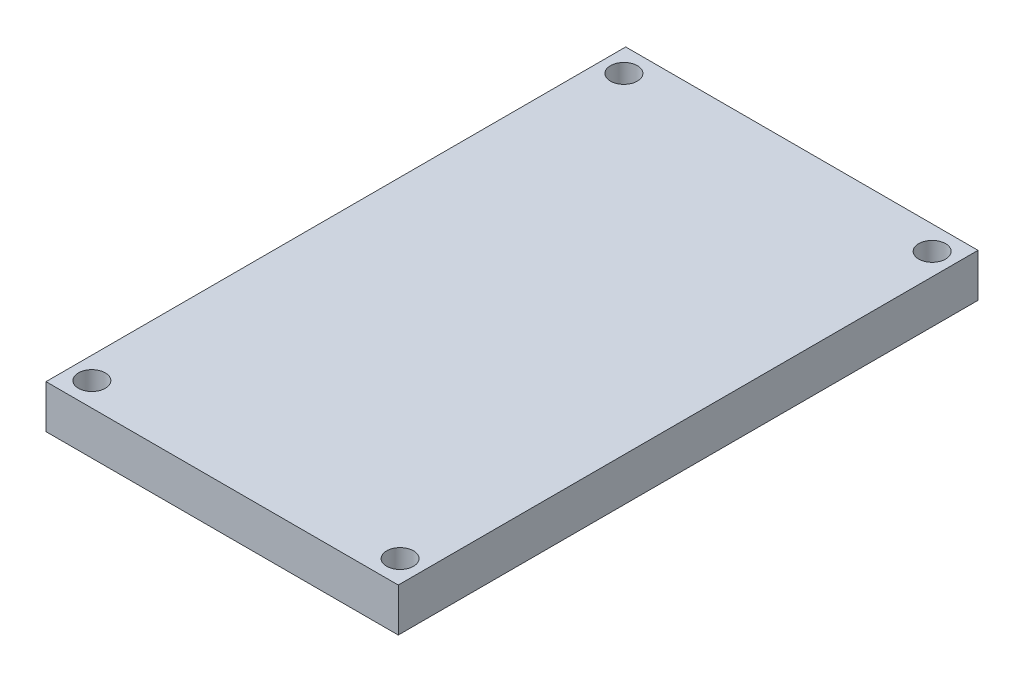
from build123d import *

# Parameters (mm, degrees)
SKETCH_1_W      = 40.64
SKETCH_1_H      = 66.88
SKETCH_1_R      = 1.55
EXTRUDE_1_DEPTH = 5


with BuildPart() as part:
    # 草图1 → 凸台-拉伸1 (new body)
    with BuildSketch(Plane(origin=(0, 0, 0), x_dir=(1, 0, 0), z_dir=(0, 1, 0))):
        Rectangle(SKETCH_1_W, SKETCH_1_H)
        with Locations(Location((-17.78, 30.69, 0), (0, 0, 270))):
            Circle(SKETCH_1_R, mode=Mode.SUBTRACT)
        with Locations(Location((17.78, 30.69, 0), (0, 0, 90))):
            Circle(SKETCH_1_R, mode=Mode.SUBTRACT)
        with Locations(Location((17.78, -30.69, 0), (0, 0, 270))):
            Circle(SKETCH_1_R, mode=Mode.SUBTRACT)
        with Locations(Location((-17.78, -30.69, 0), (0, 0, 90))):
            Circle(SKETCH_1_R, mode=Mode.SUBTRACT)
    extrude(amount=EXTRUDE_1_DEPTH)


solid = part.part
